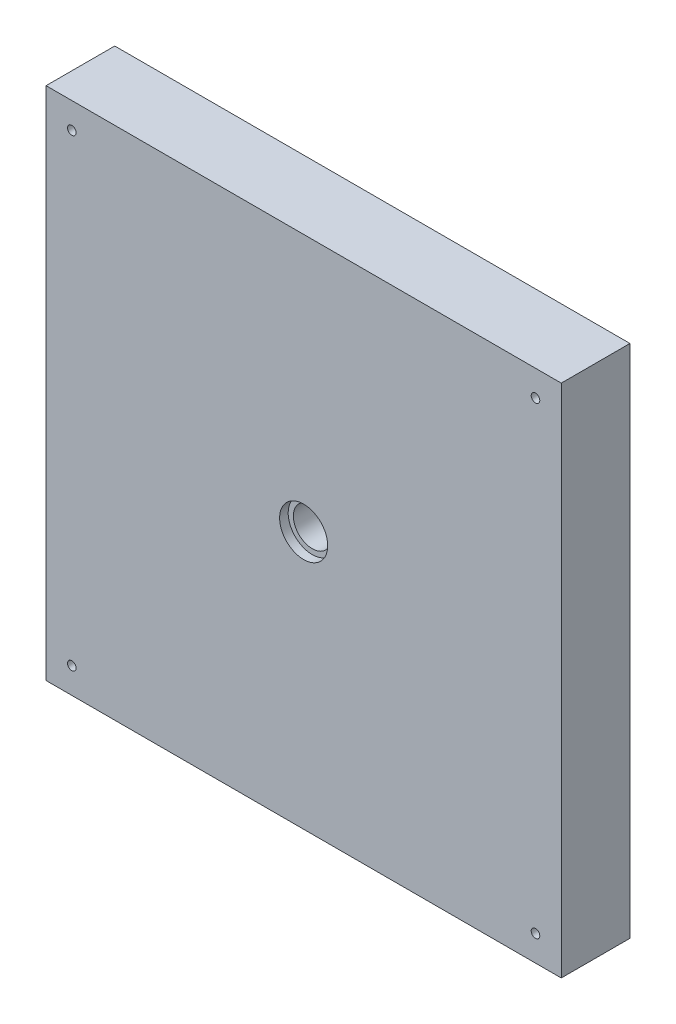
from build123d import *

# Parameters (mm, degrees)
SKETCH_1_W          = 300
SKETCH_1_H          = 300
EXTRUDE_1_DEPTH     = 40
SKETCH_2_R          = 11
CUT_EXTRUDE_1_DEPTH = 427.145515053
M6X1_0_1_D          = 5
M6X1_0_1_DEPTH      = 17
M6X1_0_1_TIP        = 1.502151548
M6X1_0_2_D          = 5
M6X1_0_2_DEPTH      = 17
M6X1_0_2_TIP        = 1.502151548
M6X1_0_3_D          = 5
M6X1_0_3_DEPTH      = 17
M6X1_0_3_TIP        = 1.502151548
M6X1_0_4_D          = 5
M6X1_0_4_DEPTH      = 17
M6X1_0_4_TIP        = 1.502151548
SKETCH_3_R          = 14
CUT_EXTRUDE_2_DEPTH = 5
CHAMFER_1_SIZE      = 1
CHAMFER_2_SIZE      = 1
CHAMFER_3_SIZE      = 1
CHAMFER_4_SIZE      = 1
M6X1_0_5_D          = 5


with BuildPart() as part:
    # ｽｹｯﾁ1 → ﾎﾞｽ - 押し出し1 (new body)
    with BuildSketch(Plane.XY):
        with Locations((150, -150)):
            Rectangle(SKETCH_1_W, SKETCH_1_H)
    extrude(amount=EXTRUDE_1_DEPTH)

    # ｽｹｯﾁ2 → ｶｯﾄ - 押し出し1 (cut, through all)
    with BuildSketch(Plane.XY.offset(40)):
        with Locations((150, -150)):
            Circle(SKETCH_2_R)
    extrude(amount=-CUT_EXTRUDE_1_DEPTH, mode=Mode.SUBTRACT)

    # M6x1.0 ねじ穴1
    with Locations(Plane(origin=(0, 0, 0), x_dir=(-1, 0, 0), z_dir=(0, 0, -1))):
        with Locations((-260, -150)):
            Hole(M6X1_0_1_D / 2, depth=M6X1_0_1_DEPTH)
            with Locations((0, 0, -(M6X1_0_1_DEPTH + M6X1_0_1_TIP / 2))):  # 118° drill point
                Cone(0, M6X1_0_1_D / 2, M6X1_0_1_TIP, mode=Mode.SUBTRACT)

    # M6x1.0 ねじ穴2
    with Locations(Plane(origin=(0, 0, 0), x_dir=(-1, 0, 0), z_dir=(0, 0, -1))):
        with Locations((-150, -40)):
            Hole(M6X1_0_2_D / 2, depth=M6X1_0_2_DEPTH)
            with Locations((0, 0, -(M6X1_0_2_DEPTH + M6X1_0_2_TIP / 2))):  # 118° drill point
                Cone(0, M6X1_0_2_D / 2, M6X1_0_2_TIP, mode=Mode.SUBTRACT)

    # M6x1.0 ねじ穴3
    with Locations(Plane(origin=(40, -150, 0), x_dir=(-1, 0, 0), z_dir=(0, 0, -1))):
        with Locations((0, 0)):
            Hole(M6X1_0_3_D / 2, depth=M6X1_0_3_DEPTH)
            with Locations((0, 0, -(M6X1_0_3_DEPTH + M6X1_0_3_TIP / 2))):  # 118° drill point
                Cone(0, M6X1_0_3_D / 2, M6X1_0_3_TIP, mode=Mode.SUBTRACT)

    # M6x1.0 ねじ穴4
    with Locations(Plane(origin=(150, -260, 0), x_dir=(-1, 0, 0), z_dir=(0, 0, -1))):
        with Locations((0, 0)):
            Hole(M6X1_0_4_D / 2, depth=M6X1_0_4_DEPTH)
            with Locations((0, 0, -(M6X1_0_4_DEPTH + M6X1_0_4_TIP / 2))):  # 118° drill point
                Cone(0, M6X1_0_4_D / 2, M6X1_0_4_TIP, mode=Mode.SUBTRACT)

    # ｽｹｯﾁ3 → ｶｯﾄ - 押し出し2 (cut)
    with BuildSketch(Plane.XY.offset(40)):
        with Locations((150, -150)):
            Circle(SKETCH_3_R)
    extrude(amount=-CUT_EXTRUDE_2_DEPTH, mode=Mode.SUBTRACT)

    # 面取り1
    chamfer_1_edges = [part.edges().sort_by_distance(p)[0] for p in [
        (257.5, -150, 0),
    ]]
    chamfer(chamfer_1_edges, length=CHAMFER_1_SIZE)

    # 面取り2
    chamfer_2_edges = [part.edges().sort_by_distance(p)[0] for p in [
        (147.5, -40, 0),
    ]]
    chamfer(chamfer_2_edges, length=CHAMFER_2_SIZE)

    # 面取り3
    chamfer_3_edges = [part.edges().sort_by_distance(p)[0] for p in [
        (147.5, -260, 0),
    ]]
    chamfer(chamfer_3_edges, length=CHAMFER_3_SIZE)

    # 面取り4
    chamfer_4_edges = [part.edges().sort_by_distance(p)[0] for p in [
        (37.5, -150, 0),
    ]]
    chamfer(chamfer_4_edges, length=CHAMFER_4_SIZE)

    # M6x1.0 ねじ穴5 (through all)
    with Locations(Plane(origin=(285, -15, 0), x_dir=(-1, 0, 0), z_dir=(0, 0, -1))):
        with Locations((0, 0), (270, 0), (270, -270), (0, -270)):
            Hole(M6X1_0_5_D / 2)


solid = part.part
